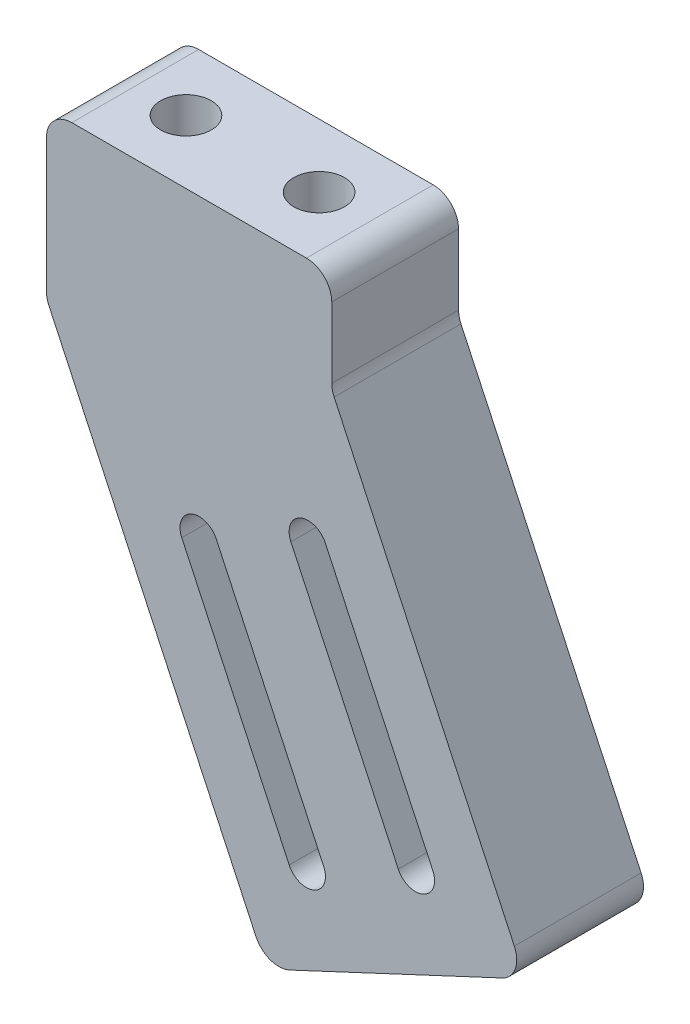
from build123d import *

# Parameters (mm, degrees)
BOSS_EXTRUDE1_DEPTH          = 10
F_4_0_4_DIAMETER_HOLE1_D     = 4
F_4_0_4_DIAMETER_HOLE1_DEPTH = 15
F_4_0_4_DIAMETER_HOLE1_TIP   = 1.201721238
SKETCH6_W                    = 7.5
SKETCH6_H                    = 2.7
CUT_EXTRUDE1_DEPTH           = 8.75
FILLET1_R                    = 2


with BuildPart() as part:
    # Sketch1 → Boss-Extrude1 (new body)
    with BuildSketch(Plane.XY):
        Polygon((0, 0), (22.5, 0), (22.5, -8), (37.747058824, -40.611764706), (17.364705882, -50.141176471), (0, -13), align=None)
        with BuildLine():
            Line((13.388235294, -22.747058824), (21.858823529, -40.864705882))
            ThreePointArc((21.858823529, -40.864705882), (21.135294118, -42.858823529), (19.141176471, -42.135294118))
            Line((19.141176471, -42.135294118), (10.670588235, -24.017647059))
            ThreePointArc((10.670588235, -24.017647059), (11.394117647, -22.023529412), (13.388235294, -22.747058824))
        make_face(mode=Mode.SUBTRACT)
        with BuildLine():
            Line((21.994117647, -18.723529412), (30.464705882, -36.841176471))
            ThreePointArc((30.464705882, -36.841176471), (29.741176471, -38.835294118), (27.747058824, -38.111764706))
            Line((27.747058824, -38.111764706), (19.276470588, -19.994117647))
            ThreePointArc((19.276470588, -19.994117647), (20, -18), (21.994117647, -18.723529412))
        make_face(mode=Mode.SUBTRACT)
    extrude(amount=BOSS_EXTRUDE1_DEPTH)

    # Ø4.0 (4) Diameter Hole1
    with Locations(Plane(origin=(0, 0, 0), x_dir=(1, 0, 0), z_dir=(0, 1, 0))):
        with Locations((6, -5), (16.5, -5)):
            Hole(F_4_0_4_DIAMETER_HOLE1_D / 2, depth=F_4_0_4_DIAMETER_HOLE1_DEPTH)
            with Locations((0, 0, -(F_4_0_4_DIAMETER_HOLE1_DEPTH + F_4_0_4_DIAMETER_HOLE1_TIP / 2))):  # 118° drill point
                Cone(0, F_4_0_4_DIAMETER_HOLE1_D / 2, F_4_0_4_DIAMETER_HOLE1_TIP, mode=Mode.SUBTRACT)

    # Sketch6 → Cut-Extrude1 (cut)
    with BuildSketch(Plane.XY):
        with Locations((6, -6.35)):
            Rectangle(SKETCH6_W, SKETCH6_H)
        with Locations((16.5, -6.35)):
            Rectangle(SKETCH6_W, SKETCH6_H)
    extrude(amount=CUT_EXTRUDE1_DEPTH, mode=Mode.SUBTRACT)

    # Fillet1
    fillet1_edges = [part.edges().sort_by_distance(p)[0] for p in [
        (0, 0, 5),
        (22.5, 0, 5),
        (22.5, -8, 5),
        (37.747058824, -40.611764706, 5),
        (17.364705882, -50.141176471, 5),
        (0, -13, 5),
    ]]
    fillet(fillet1_edges, radius=FILLET1_R)


solid = part.part
